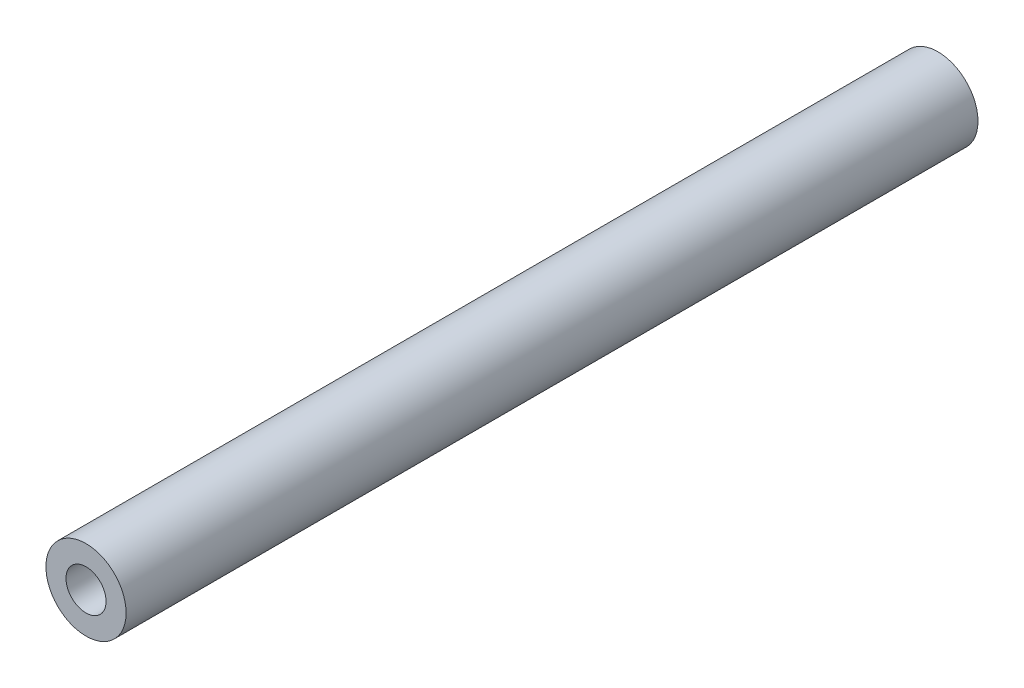
from build123d import *

# Parameters (mm, degrees)
SKETCH2_R           = 101.6
SKETCH2_R_2         = 50.8
BOSS_EXTRUDE1_DEPTH = 1079.5


with BuildPart() as part:
    # Sketch2 → Boss-Extrude1 (new, symmetric)
    with BuildSketch(Plane.XY):
        Circle(SKETCH2_R)
        Circle(SKETCH2_R_2, mode=Mode.SUBTRACT)
    extrude(amount=BOSS_EXTRUDE1_DEPTH, both=True)


solid = part.part
